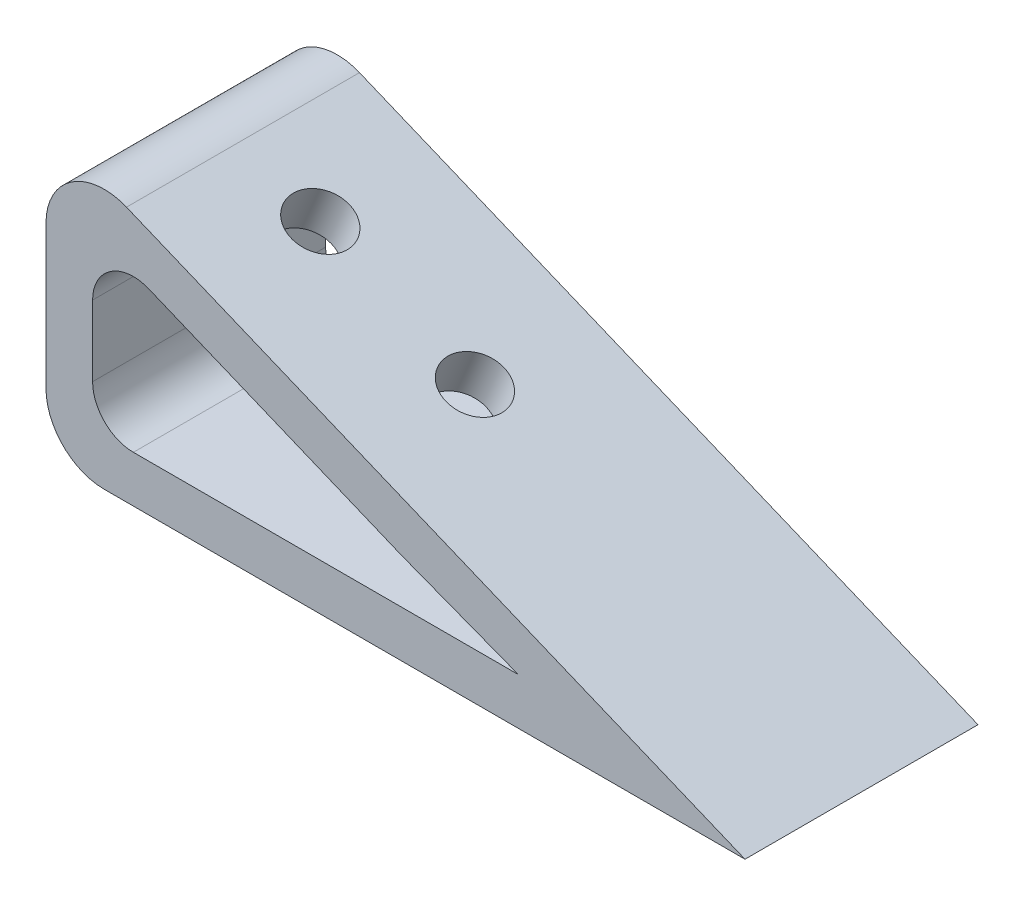
from build123d import *

# Parameters (mm, degrees)
BOSS_EXTRU_1_DEPTH      = 10
ESQUISSE2_R             = 2.5
ENL_V_MAT_EXTRU_1_DEPTH = 8


with BuildPart() as part:
    # Esquisse1 → Boss.-Extru.1 (new, symmetric)
    with BuildSketch(Plane.XY):
        with BuildLine():
            Line((46.618888989, 57.076719782), (101.618888989, 57.076719782))
            Line((101.618888989, 57.076719782), (48.527534404, 79.003668292))
            ThreePointArc((48.527534404, 79.003668292), (43.838891424, 78.538210075), (41.618888989, 74.382296994))
            Line((41.618888989, 74.382296994), (41.618888989, 62.076719782))
            ThreePointArc((41.618888989, 62.076719782), (43.083355083, 58.541185876), (46.618888989, 57.076719782))
        make_face()
        with BuildLine():
            Line((72.136693702, 64.925268301), (50.45494078, 73.879921722))
            ThreePointArc((50.45494078, 73.879921722), (47.172890694, 73.554100969), (45.618888989, 70.644961813))
            Line((45.618888989, 70.644961813), (45.618888989, 64.576719782))
            ThreePointArc((45.618888989, 64.576719782), (46.644015255, 62.101846047), (49.118888989, 61.076719782))
            Line((49.118888989, 61.076719782), (71.373235536, 61.076719782))
            Line((71.373235536, 61.076719782), (82.169018373, 61.076719782))
            Line((82.169018373, 61.076719782), (72.136693702, 64.925268301))
        make_face(mode=Mode.SUBTRACT)
    extrude(amount=BOSS_EXTRU_1_DEPTH, both=True)

    # Esquisse2 → Enlèv. mat.-Extru.1 (cut)
    with BuildSketch(Plane(origin=(34.945552376, 84.613082912, 0), x_dir=(0.9242742597143897, -0.38172908302802533, 0), z_dir=(0.3817290830280253, 0.9242742597143896, 0))):
        with Locations(Location((21.875034686, 0, 0), (0, 0, 180))):
            Circle(ESQUISSE2_R)
        with Locations(Location((36.235316287, 0, 0), (0, 0, 180))):
            Circle(ESQUISSE2_R)
    extrude(amount=-ENL_V_MAT_EXTRU_1_DEPTH, mode=Mode.SUBTRACT)


solid = part.part
